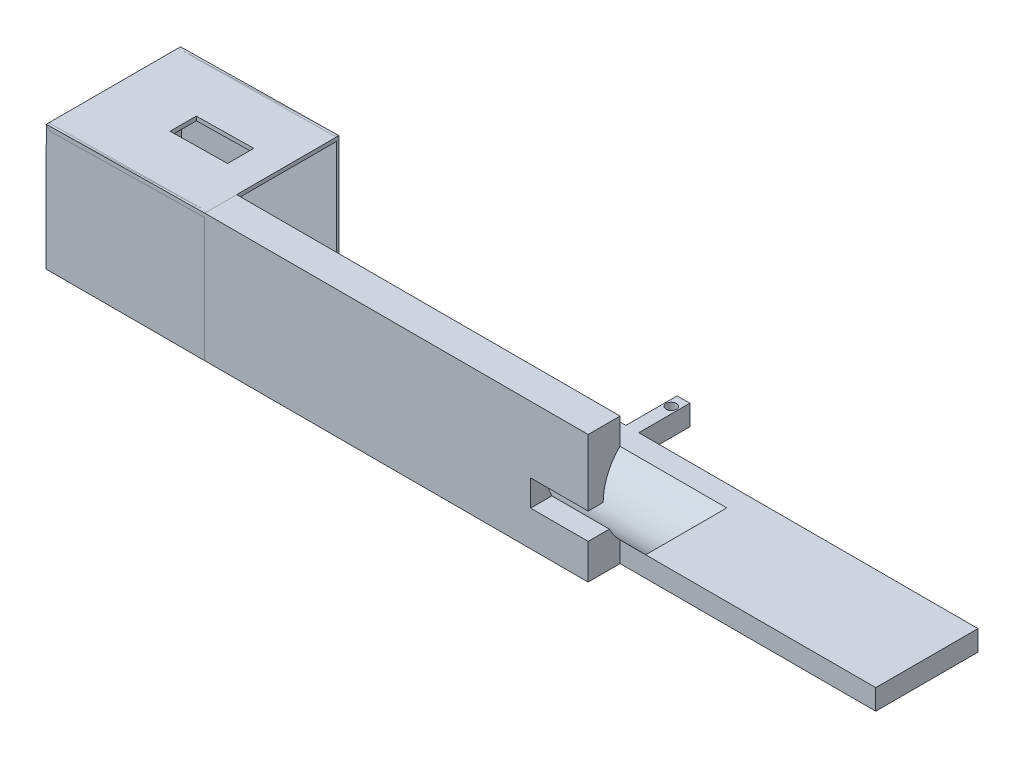
from build123d import *

# Parameters (mm, degrees)
SKETCH1_W            = 500
SKETCH1_H            = 80
BOSS_EXTRUDE1_DEPTH  = 16
SKETCH9_W            = 300
SKETCH9_H            = 100
BOSS_EXTRUDE5_DEPTH  = 25
SKETCH12_R           = 45
CUT_EXTRUDE4_DEPTH   = 320
SKETCH13_W           = 45
SKETCH13_H           = 20.5
CUT_EXTRUDE5_DEPTH   = 40
SKETCH14_W           = 10
SKETCH14_H           = 16
BOSS_EXTRUDE6_DEPTH  = 40
SKETCH15_R           = 4
CUT_EXTRUDE6_DEPTH   = 40
BOSS_EXTRUDE7_REACH  = 532.118
BOSS_EXTRUDE8_DEPTH  = 2
BOSS_EXTRUDE10_DEPTH = 2
SKETCH22_W           = 45
SKETCH22_H           = 20.5
CUT_EXTRUDE9_DEPTH   = 152


with BuildPart() as part:
    # Sketch1 → Boss-Extrude1 (new body)
    with BuildSketch(Plane(origin=(0, 0, 0), x_dir=(1, 0, 0), z_dir=(0, 1, 0))):
        with Locations((250, -40)):
            Rectangle(SKETCH1_W, SKETCH1_H)
    extrude(amount=BOSS_EXTRUDE1_DEPTH)

    # Sketch9 → Boss-Extrude5 (add)
    with BuildSketch(Plane.XY.offset(80)):
        with Locations((150, 50)):
            Rectangle(SKETCH9_W, SKETCH9_H)
    extrude(amount=BOSS_EXTRUDE5_DEPTH)

    # Sketch12 → Cut-Extrude4 (cut)
    with BuildSketch(Plane.ZY):
        with Locations((48.257619972, 47.909037796)):
            Circle(SKETCH12_R)
    extrude(amount=-CUT_EXTRUDE4_DEPTH, mode=Mode.SUBTRACT)

    # Sketch13 → Cut-Extrude5 (cut)
    with BuildSketch(Plane.XY.offset(105)):
        with Locations((277.5, 37.838827437)):
            Rectangle(SKETCH13_W, SKETCH13_H)
    extrude(amount=-CUT_EXTRUDE5_DEPTH, mode=Mode.SUBTRACT)

    # Sketch14 → Boss-Extrude6 (add)
    with BuildSketch(Plane(origin=(0, 0, 0), x_dir=(-1, 0, 0), z_dir=(0, 0, -1))):
        with Locations((-229.6, 8)):
            Rectangle(SKETCH14_W, SKETCH14_H)
    extrude(amount=BOSS_EXTRUDE6_DEPTH)

    # Sketch15 → Cut-Extrude6 (cut)
    with BuildSketch(Plane(origin=(0, 16, 0), x_dir=(1, 0, 0), z_dir=(0, 1, 0))):
        with Locations(Location((229.494020101, 30.562557787, 0), (0, 0, 270))):
            Circle(SKETCH15_R)
    extrude(amount=-CUT_EXTRUDE6_DEPTH, mode=Mode.SUBTRACT)

    # Boss-Extrude7: up to this face of the body (flat: up to its plane)
    boss_extrude7_end = Plane(part.part.faces().sort_by_distance((112.3, 8, 0))[0])
    # Sketch16 → Boss-Extrude7 (add, up to the picked face)
    with BuildSketch(Plane.XY.offset(105), mode=Mode.PRIVATE) as boss_extrude7_sk1:
        Polygon((0, 100), (0, 97.020005021), (-121.017630719, 94.99244459), (-121.017630719, 0), (-123.915883819, 0), (-123.915883819, 98.227782534), align=None)
    boss_extrude7_tool1 = split(extrude(boss_extrude7_sk1.sketch, amount=-BOSS_EXTRUDE7_REACH, mode=Mode.PRIVATE), bisect_by=boss_extrude7_end, keep=Keep.BOTH, mode=Mode.PRIVATE)
    add(boss_extrude7_tool1.solids().sort_by(Axis((-1.59233, 98.510003, 105), (0, 0, -1)))[0])

    # Sketch22 → Cut-Extrude9 (cut)
    with BuildSketch(Plane(origin=(-1.429885334, 99.979550097, 0), x_dir=(0.9998977452585963, 0.014300315618031738, 0), z_dir=(-0.014300315618031738, 0.9998977452585963, 0))):
        with Locations((-46.069968438, -51.81530803)):
            Rectangle(SKETCH22_W, SKETCH22_H)
    extrude(amount=-CUT_EXTRUDE9_DEPTH, mode=Mode.SUBTRACT)


with BuildPart() as body_2:
    # Sketch17 → Boss-Extrude8 (new body)
    with BuildSketch(Plane.XY.offset(105)):
        Polygon((-124.14317248, 0), (0, 0), (0, 100), (-123.915883819, 98.227782534), align=None)
    extrude(amount=-BOSS_EXTRUDE8_DEPTH)


with BuildPart() as body_3:
    # Sketch19 → Boss-Extrude10 (new body)
    with BuildSketch(Plane(origin=(0, 0, 0), x_dir=(-1, 0, 0), z_dir=(0, 0, -1))):
        Polygon((0, 100), (0, 0), (124.14317248, 0), (123.915883819, 98.227782534), align=None)
    extrude(amount=-BOSS_EXTRUDE10_DEPTH)


solid = Compound([part.part, body_2.part, body_3.part])
